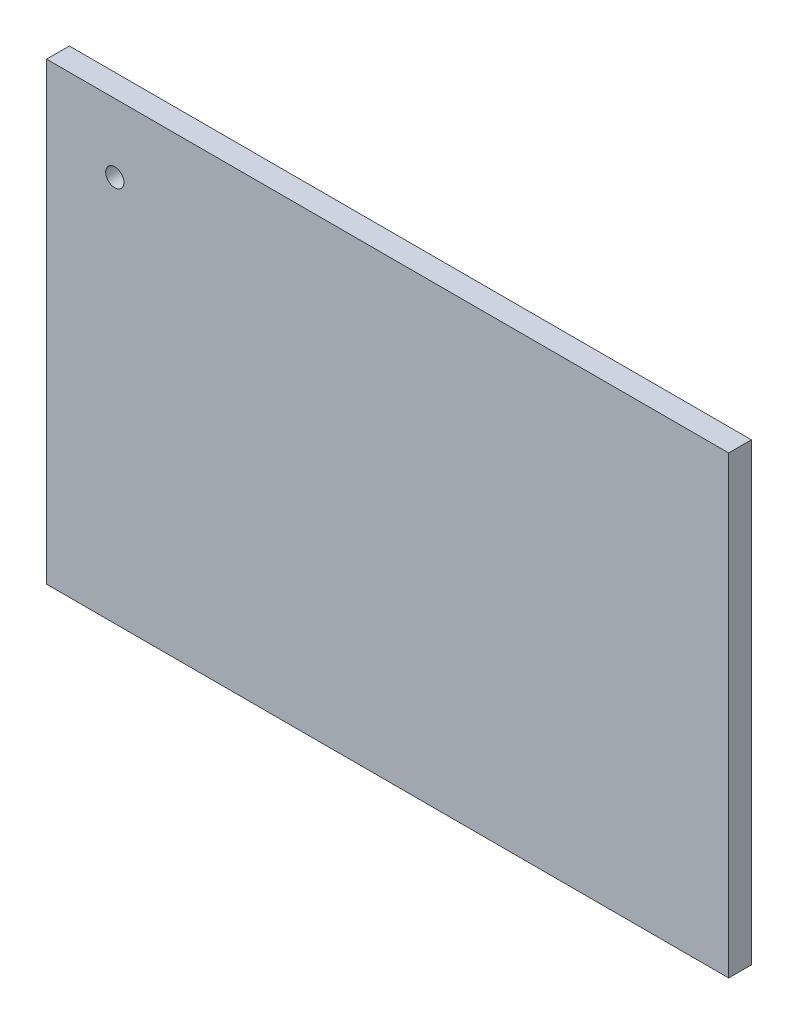
from build123d import *

# Parameters (mm, degrees)
SKETCH_1_W          = 300
SKETCH_1_H          = 200
EXTRUDE_1_DEPTH     = 10
SKETCH_2_R          = 4
CUT_EXTRUDE_1_DEPTH = 10


with BuildPart() as part:
    # 草图1 → 凸台-拉伸1 (new body)
    with BuildSketch(Plane.XY):
        Rectangle(SKETCH_1_W, SKETCH_1_H)
    extrude(amount=EXTRUDE_1_DEPTH)

    # 草图2 → 切除-拉伸1 (cut)
    with BuildSketch(Plane.XY.offset(10)):
        with Locations((-120, 70)):
            Circle(SKETCH_2_R)
    extrude(amount=-CUT_EXTRUDE_1_DEPTH, mode=Mode.SUBTRACT)


solid = part.part
